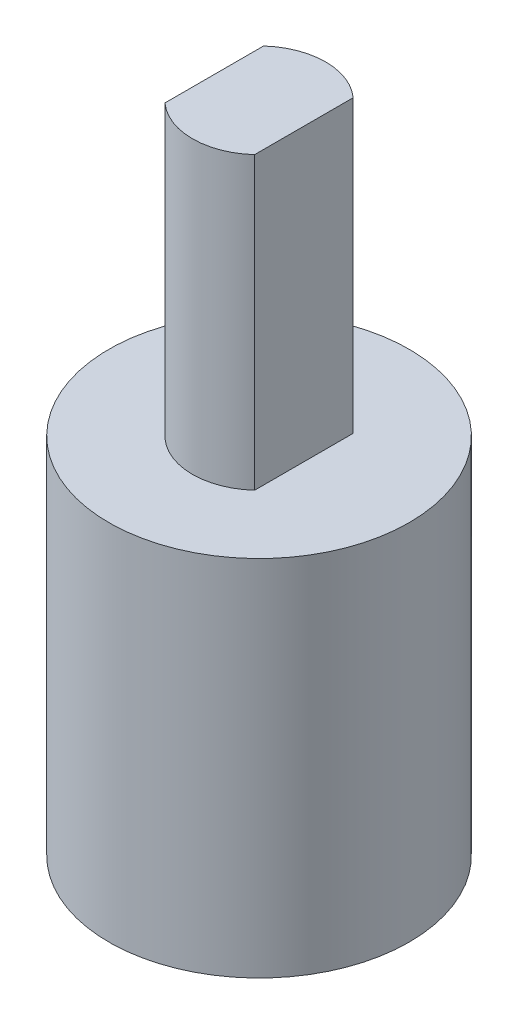
from build123d import *

# Parameters (mm, degrees)
CORTAR_EXTRUIR1_DEPTH = 18.374694242


with BuildPart() as part:
    # Croquis3 → Revolución1 (revolve)
    with BuildSketch(Plane.XY):
        Polygon((3.2, 0), (6.2, 0), (6.2, 15), (2.75, 15), (2.75, 27), (0, 27), (0, 13), (3.2, 13), align=None)
    revolve(axis=Axis((0, -169.632312065, 0), (0, 1, 0)))

    # Croquis4 → Cortar-Extruir1 (cut, through all)
    with BuildSketch(Plane(origin=(0, 15, 0), x_dir=(1, 0, 0), z_dir=(0, 1, 0))):
        with BuildLine():
            Line((1.85, 2.034698995), (1.85, -2.034698995))
            ThreePointArc((1.85, -2.034698995), (2.75, 0), (1.85, 2.034698995))
        make_face()
        with BuildLine():
            Line((-1.85, 2.034698995), (-1.85, -2.034698995))
            ThreePointArc((-1.85, -2.034698995), (-2.75, 0), (-1.85, 2.034698995))
        make_face()
    extrude(amount=CORTAR_EXTRUIR1_DEPTH, mode=Mode.SUBTRACT)


solid = part.part
